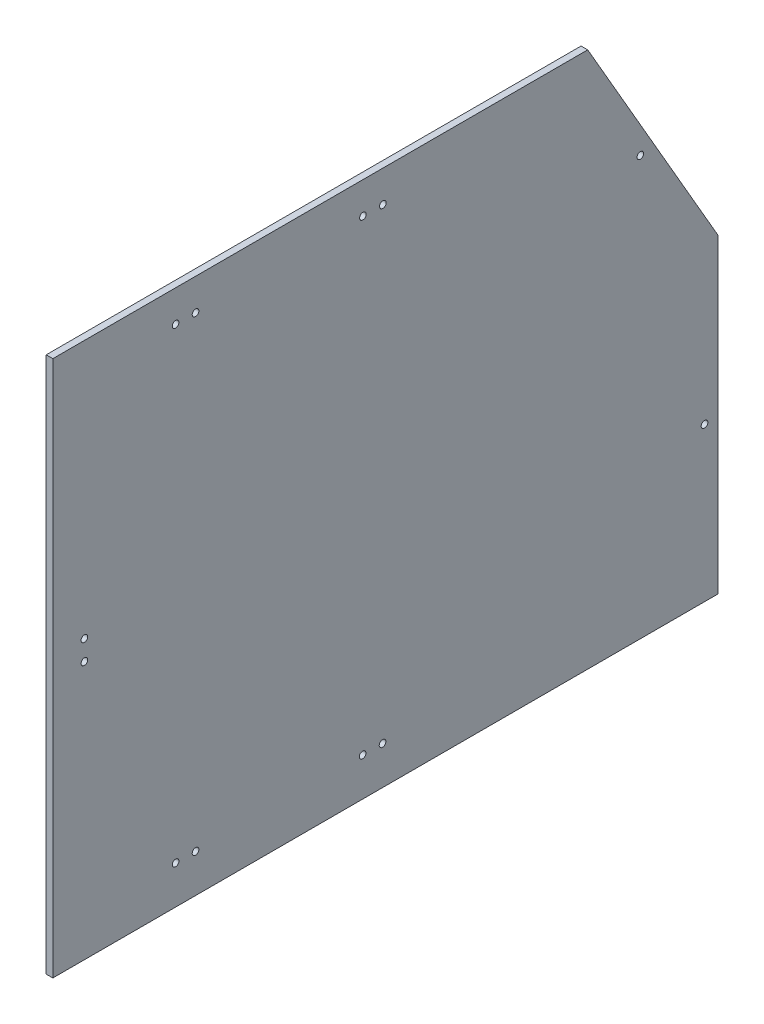
from build123d import *

# Parameters (mm, degrees)
BOSS_EXTRUDE1_DEPTH = 3
SKETCH2_R           = 1.5
CUT_EXTRUDE1_DEPTH  = 10
CUT_EXTRUDE2_DEPTH  = 10


with BuildPart() as part:
    # Sketch1 → Boss-Extrude1 (new body)
    with BuildSketch(Plane(origin=(0, 0, 0), x_dir=(0, 0, -1), z_dir=(1, 0, 0))):
        Polygon((-213.248407643, 113.180191083), (-213.248407643, -128.789808917), (86.751592357, -128.789808917), (86.751592357, 11.510191083), (28.052390488, 113.180191083), align=None)
    extrude(amount=BOSS_EXTRUDE1_DEPTH)

    # Sketch2 → Cut-Extrude1 (cut)
    with BuildSketch(Plane(origin=(3, 0, 0), x_dir=(0, 0, -1), z_dir=(1, 0, 0))):
        with Locations((-157.867084277, -111.53685774)):
            Circle(SKETCH2_R)
        with Locations((-148.867084277, -111.53685774)):
            Circle(SKETCH2_R)
        with Locations((-73.502207501, -111.53685774)):
            Circle(SKETCH2_R)
        with Locations((-64.502207501, -111.53685774)):
            Circle(SKETCH2_R)
        with Locations((-64.354867412, 98.927239906)):
            Circle(SKETCH2_R)
        with Locations((-73.354867412, 98.927239906)):
            Circle(SKETCH2_R)
        with Locations((-148.867084277, 98.927239906)):
            Circle(SKETCH2_R)
        with Locations((-157.867084277, 98.927239906)):
            Circle(SKETCH2_R)
        with Locations((-198.995456466, -3.304808917)):
            Circle(SKETCH2_R)
        with Locations((-198.995456466, -12.304808917)):
            Circle(SKETCH2_R)
    extrude(amount=-CUT_EXTRUDE1_DEPTH, mode=Mode.SUBTRACT)

    # Sketch3 → Cut-Extrude2 (cut)
    with BuildSketch(Plane(origin=(3, 0, 0), x_dir=(0, 0, -1), z_dir=(1, 0, 0))):
        with BuildLine():
            ThreePointArc((80.751592357, -57.943656494), (79.251592357, -59.443656494), (80.751592357, -60.943656494))
            Line((80.751592357, -60.943656494), (80.751592357, -57.943656494))
        make_face()
        with BuildLine():
            Line((80.751592357, -57.943656494), (80.751592357, -60.943656494))
            ThreePointArc((80.751592357, -60.943656494), (81.812252528, -60.504316666), (82.251592357, -59.443656494))
            ThreePointArc((82.251592357, -59.443656494), (81.812252528, -58.382996323), (80.751592357, -57.943656494))
        make_face()
        with BuildLine():
            ThreePointArc((51.053915211, 61.340381611), (50.504877105, 59.291343506), (52.553915211, 58.7423054))
            Line((52.553915211, 58.7423054), (51.053915211, 61.340381611))
        make_face()
        with BuildLine():
            Line((51.053915211, 61.340381611), (52.553915211, 58.7423054))
            ThreePointArc((52.553915211, 58.7423054), (53.102953317, 59.291343506), (53.303915211, 60.041343506))
            ThreePointArc((53.303915211, 60.041343506), (52.553915211, 61.340381611), (51.053915211, 61.340381611))
        make_face()
    extrude(amount=-CUT_EXTRUDE2_DEPTH, mode=Mode.SUBTRACT)


solid = part.part
